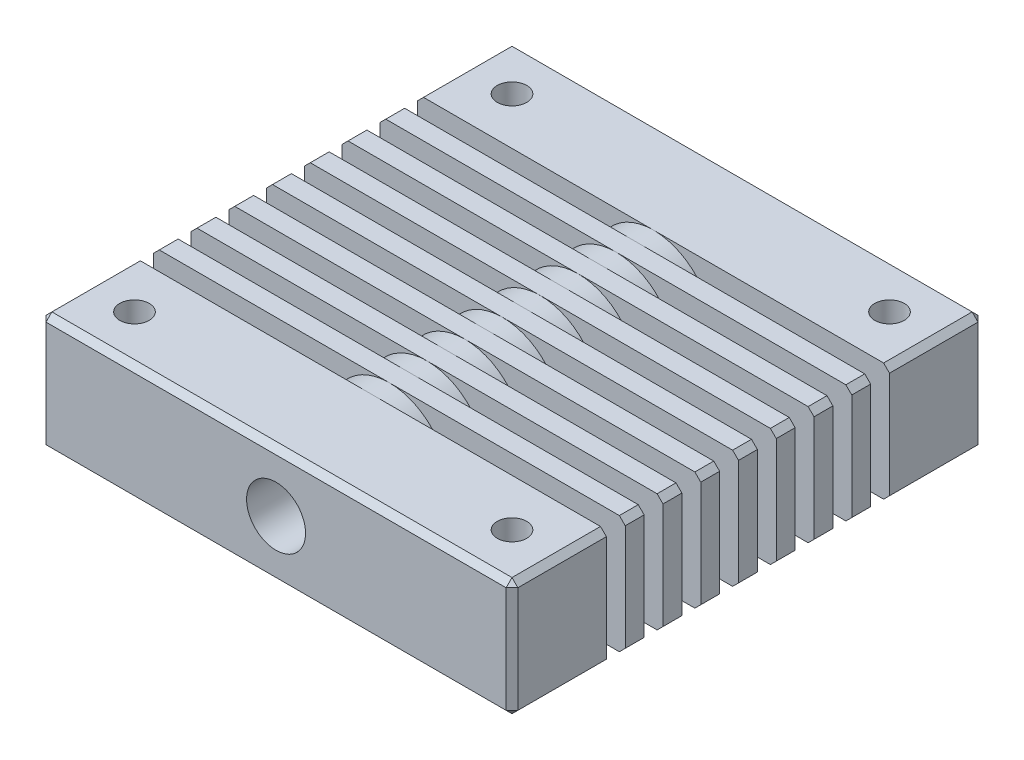
from build123d import *

# Parameters (mm, degrees)
ESQUISSE2_W                                   = 40
ESQUISSE2_H                                   = 10
BOSS_EXTRU_1_DEPTH                            = 40
DIAM_TRE_DU_PER_AGE_4_1_4_1_1_D               = 4.1
TROU_POUR_TARAUDAGE_POUR_TROU_TARAUD_M6_D     = 5
TROU_POUR_TARAUDAGE_POUR_TROU_TARAUD_M6_DEPTH = 8
TROU_POUR_TARAUDAGE_POUR_TROU_TARAUD_M6_TIP   = 1.502151548
DIAM_TRE_DU_PER_AGE_6_0_6_1_D                 = 6
DIAM_TRE_DU_PER_AGE_6_0_6_1_DEPTH             = 20
DIAM_TRE_DU_PER_AGE_6_0_6_1_TIP               = 1.802581857
TROU_POUR_TARAUDAGE_POUR_TROU_TARAUD_M3_D     = 2.5
TROU_POUR_TARAUDAGE_POUR_TROU_TARAUD_2_D      = 2.5
TROU_POUR_TARAUDAGE_POUR_TROU_TARAUD_2_DEPTH  = 5
TROU_POUR_TARAUDAGE_POUR_TROU_TARAUD_2_TIP    = 0.751075774
CHANFREIN1_SIZE                               = 0.5
ENL_V_START                                   = 8
ESQUISSE20_R                                  = 26.193290648
ESQUISSE20_R_2                                = 5
ENL_V_MAT_EXTRU_1_DEPTH                       = 1.6
R_P_TITION_LIN_AIRE1_COUNT                    = 8
R_P_TITION_LIN_AIRE1_PITCH                    = 3.2


with BuildPart() as part:
    # Esquisse2 → Boss.-Extru.1 (new body)
    with BuildSketch(Plane.XY):
        with Locations((20, 5)):
            Rectangle(ESQUISSE2_W, ESQUISSE2_H)
    extrude(amount=BOSS_EXTRU_1_DEPTH)

    # Diamètre du perçage Ø4.1 (4.1)1 (through all)
    with Locations(Plane.XY.offset(40)):
        with Locations((20, 5)):
            Hole(DIAM_TRE_DU_PER_AGE_4_1_4_1_1_D / 2)

    # Trou pour taraudage pour trou taraudé M61
    with Locations(Plane.XY.offset(40)):
        with Locations((20, 5)):
            Hole(TROU_POUR_TARAUDAGE_POUR_TROU_TARAUD_M6_D / 2, depth=TROU_POUR_TARAUDAGE_POUR_TROU_TARAUD_M6_DEPTH)
            with Locations((0, 0, -(TROU_POUR_TARAUDAGE_POUR_TROU_TARAUD_M6_DEPTH + TROU_POUR_TARAUDAGE_POUR_TROU_TARAUD_M6_TIP / 2))):  # 118° drill point
                Cone(0, TROU_POUR_TARAUDAGE_POUR_TROU_TARAUD_M6_D / 2, TROU_POUR_TARAUDAGE_POUR_TROU_TARAUD_M6_TIP, mode=Mode.SUBTRACT)

    # Diamètre du perçage Ø6.0 (6)1
    with Locations(Plane(origin=(0, 0, 0), x_dir=(-1, 0, 0), z_dir=(0, 0, -1))):
        with Locations((-20, 5)):
            Hole(DIAM_TRE_DU_PER_AGE_6_0_6_1_D / 2, depth=DIAM_TRE_DU_PER_AGE_6_0_6_1_DEPTH)
            with Locations((0, 0, -(DIAM_TRE_DU_PER_AGE_6_0_6_1_DEPTH + DIAM_TRE_DU_PER_AGE_6_0_6_1_TIP / 2))):  # 118° drill point
                Cone(0, DIAM_TRE_DU_PER_AGE_6_0_6_1_D / 2, DIAM_TRE_DU_PER_AGE_6_0_6_1_TIP, mode=Mode.SUBTRACT)

    # Trou pour taraudage pour trou taraud_ M3 (through all)
    with Locations(Plane(origin=(0, 0, 0), x_dir=(-1, 0, 0), z_dir=(0, -1, 0))):
        with Locations((-4, -36), (-36, -36), (-36, -4), (-4, -4)):
            Hole(TROU_POUR_TARAUDAGE_POUR_TROU_TARAUD_M3_D / 2)

    # Trou pour taraudage pour trou taraud 2
    with Locations(Plane(origin=(0, 0, 0), x_dir=(-1, 0, 0), z_dir=(0, -1, 0))):
        with Locations((-20, -4)):
            Hole(TROU_POUR_TARAUDAGE_POUR_TROU_TARAUD_2_D / 2, depth=TROU_POUR_TARAUDAGE_POUR_TROU_TARAUD_2_DEPTH)
            with Locations((0, 0, -(TROU_POUR_TARAUDAGE_POUR_TROU_TARAUD_2_DEPTH + TROU_POUR_TARAUDAGE_POUR_TROU_TARAUD_2_TIP / 2))):  # 118° drill point
                Cone(0, TROU_POUR_TARAUDAGE_POUR_TROU_TARAUD_2_D / 2, TROU_POUR_TARAUDAGE_POUR_TROU_TARAUD_2_TIP, mode=Mode.SUBTRACT)

    # Chanfrein1
    chanfrein1_edges = [part.edges().sort_by_distance(p)[0] for p in [
        (40, 5, 0),
        (20, 10, 0),
        (0, 5, 0),
        (20, 0, 0),
        (40, 10, 20),
        (40, 0, 20),
        (0, 10, 20),
        (0, 0, 20),
        (0, 5, 40),
        (20, 10, 40),
        (40, 5, 40),
        (20, 0, 40),
    ]]
    chamfer(chanfrein1_edges, length=CHANFREIN1_SIZE)

    # Esquisse20 → Enlèv. mat.-Extru.1 (cut)
    with BuildSketch(Plane(origin=(0, 40, 40), x_dir=(-1, 0, 0), z_dir=(0, 0, -1)).offset(ENL_V_START)):
        with Locations((-20, -35)):
            Circle(ESQUISSE20_R)
        with Locations((-20, -35)):
            Circle(ESQUISSE20_R_2, mode=Mode.SUBTRACT)
    enl_v_mat_extru_1 = extrude(amount=ENL_V_MAT_EXTRU_1_DEPTH, mode=Mode.SUBTRACT)

    # Répétition linéaire1: Enlèv. mat.-Extru.1 ×8
    with Locations(*[(0, 0, -i * R_P_TITION_LIN_AIRE1_PITCH) for i in range(1, R_P_TITION_LIN_AIRE1_COUNT)]):
        add(enl_v_mat_extru_1, mode=Mode.SUBTRACT)


solid = part.part
